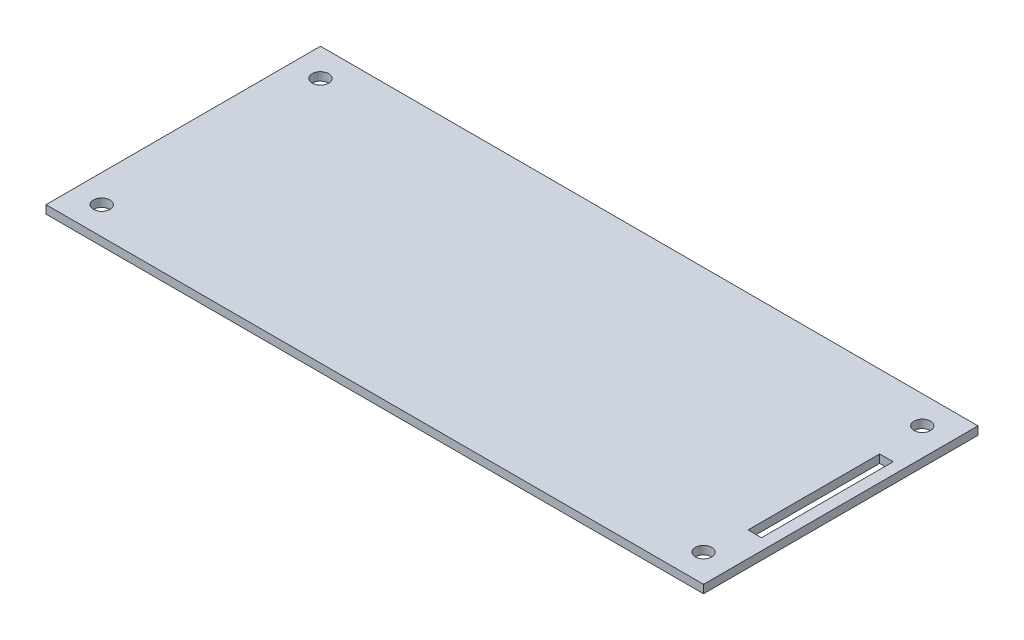
from build123d import *

# Parameters (mm, degrees)
SKETCH1_W           = 119.888
SKETCH1_H           = 50.038
SKETCH1_R           = 1.5
SKETCH1_W_2         = 2.46
SKETCH1_H_2         = 24
BOSS_EXTRUDE1_DEPTH = 1.5


with BuildPart() as part:
    # Sketch1 → Boss-Extrude1 (new body)
    with BuildSketch(Plane(origin=(0, 0, 0), x_dir=(1, 0, 0), z_dir=(0, 1, 0))):
        with Locations((59.944, -25.019)):
            Rectangle(SKETCH1_W, SKETCH1_H)
        with Locations(Location((5.08, -5.08, 0), (0, 0, 270))):
            Circle(SKETCH1_R, mode=Mode.SUBTRACT)
        with Locations(Location((114.808, -5.08, 0), (0, 0, 270))):
            Circle(SKETCH1_R, mode=Mode.SUBTRACT)
        with Locations(Location((114.808, -44.958, 0), (0, 0, 270))):
            Circle(SKETCH1_R, mode=Mode.SUBTRACT)
        with Locations(Location((5.08, -44.958, 0), (0, 0, 270))):
            Circle(SKETCH1_R, mode=Mode.SUBTRACT)
        with Locations((116.586, -25.4)):
            Rectangle(SKETCH1_W_2, SKETCH1_H_2, mode=Mode.SUBTRACT)
    extrude(amount=BOSS_EXTRUDE1_DEPTH)


solid = part.part
